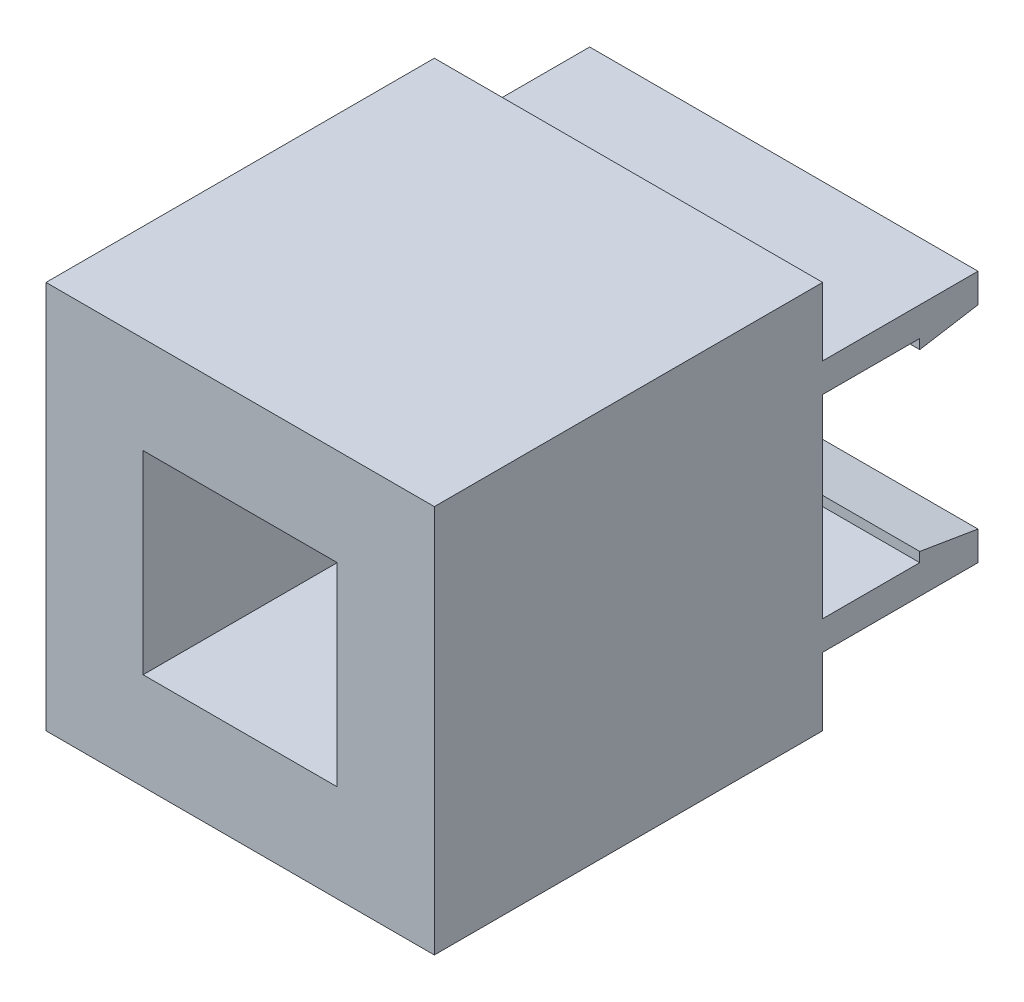
from build123d import *

# Parameters (mm, degrees)
SKETCH_1_W          = 20
SKETCH_1_H          = 20
SKETCH_1_W_2        = 10
SKETCH_1_H_2        = 10
EXTRUDE_1_DEPTH     = 20
SKETCH_2_W          = 20
SKETCH_2_H          = 3
EXTRUDE_2_DEPTH     = 5
EXTRUDE_3_DEPTH     = 20
SKETCH_4_W          = 8
SKETCH_4_H          = 1.5
CUT_EXTRUDE_1_DEPTH = 20


with BuildPart() as part:
    # 草图1 → 凸台-拉伸1 (new body)
    with BuildSketch(Plane.XY):
        with Locations((5, 5)):
            Rectangle(SKETCH_1_W, SKETCH_1_H)
        with Locations((5, 5)):
            Rectangle(SKETCH_1_W_2, SKETCH_1_H_2, mode=Mode.SUBTRACT)
    extrude(amount=EXTRUDE_1_DEPTH)

    # 草图2 → 凸台-拉伸2 (add)
    with BuildSketch(Plane(origin=(0, 0, 0), x_dir=(-1, 0, 0), z_dir=(0, 0, -1))):
        with Locations((-5, 11.5)):
            Rectangle(SKETCH_2_W, SKETCH_2_H)
        with Locations((-5, -1.5)):
            Rectangle(SKETCH_2_W, SKETCH_2_H)
    extrude(amount=EXTRUDE_2_DEPTH)

    # 草图3 → 凸台-拉伸3 (add)
    with BuildSketch(Plane.ZY.offset(5)):
        Polygon((-5, 10), (-5, 9.5), (-8, 10), (-8, 13), (-5, 13), align=None)
        Polygon((-5, 0), (-5, 0.5), (-8, 0), (-8, -3), (-5, -3), align=None)
    extrude(amount=-EXTRUDE_3_DEPTH)

    # 草图4 → 切除-拉伸1 (cut)
    with BuildSketch(Plane.ZY.offset(5)):
        with Locations((-4, 12.25)):
            Rectangle(SKETCH_4_W, SKETCH_4_H)
        with Locations((-4, -2.25)):
            Rectangle(SKETCH_4_W, SKETCH_4_H)
    extrude(amount=-CUT_EXTRUDE_1_DEPTH, mode=Mode.SUBTRACT)


solid = part.part
